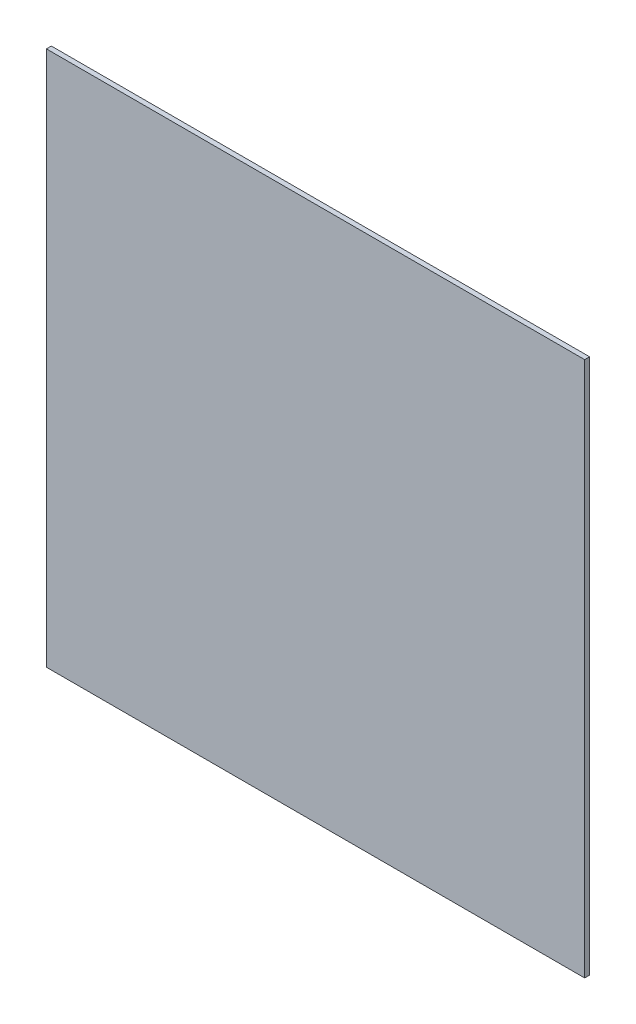
from build123d import *

# Parameters (mm, degrees)
SKETCH1_W           = 609.6
SKETCH1_H           = 606.425
BOSS_EXTRUDE1_DEPTH = 5.588


with BuildPart() as part:
    # Sketch1 → Boss-Extrude1 (new body)
    with BuildSketch(Plane.XY):
        Rectangle(SKETCH1_W, SKETCH1_H)
    extrude(amount=BOSS_EXTRUDE1_DEPTH)


solid = part.part
